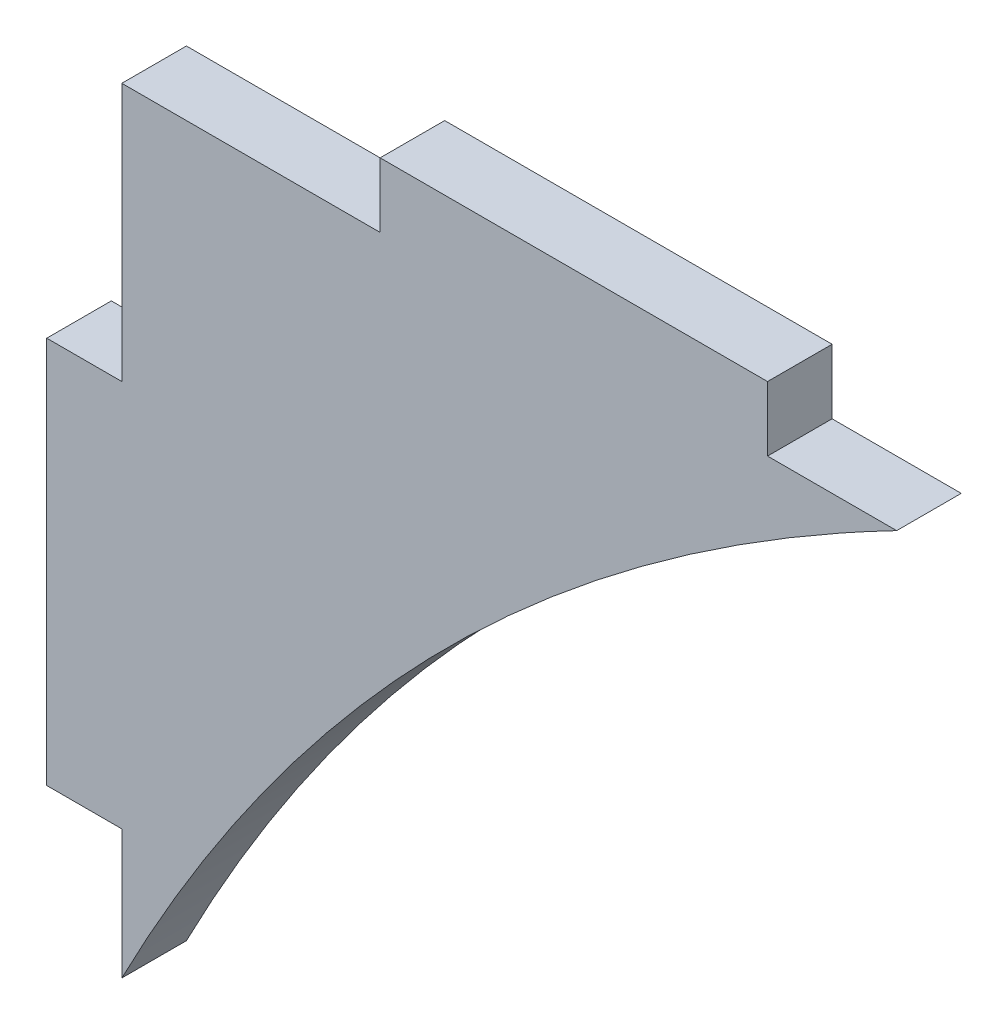
from build123d import *

# Parameters (mm, degrees)
BOSS_EXTRUDE1_DEPTH = 2.5


with BuildPart() as part:
    # Sketch1 → Boss-Extrude1 (new body)
    with BuildSketch(Plane.XY):
        with BuildLine():
            Line((-31.331144537, -8.610478528), (-31.331144537, -13.610478528))
            add(Edge.make_bspline(
                [(-31.331144537, -13.610478528), (-21.082845859, 6.19127001), (-1.331144537, 16.389521472)],
                knots=[0, 0, 0, 1, 1, 1], degree=2))
            Line((-1.331144537, 16.389521472), (-6.331144537, 16.389521472))
            Line((-6.331144537, 16.389521472), (-6.331144537, 18.889521472))
            Line((-6.331144537, 18.889521472), (-21.331144537, 18.889521472))
            Line((-21.331144537, 18.889521472), (-21.331144537, 16.389521472))
            Line((-21.331144537, 16.389521472), (-31.331144537, 16.389521472))
            Line((-31.331144537, 16.389521472), (-31.331144537, 6.389521472))
            Line((-31.331144537, 6.389521472), (-34.238029984, 6.389521472))
            Line((-34.238029984, 6.389521472), (-34.238029984, -8.610478528))
            Line((-34.238029984, -8.610478528), (-31.331144537, -8.610478528))
        make_face()
    extrude(amount=BOSS_EXTRUDE1_DEPTH)


solid = part.part
